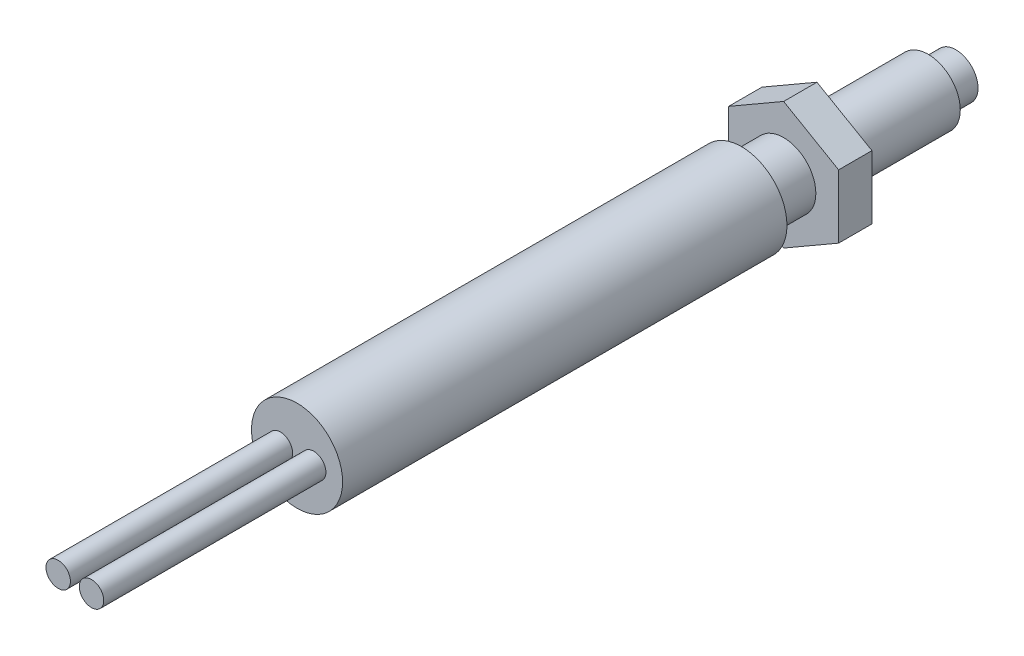
from build123d import *

# Parameters (mm, degrees)
ESQUISSE1_R        = 2.9
BOSS_EXTRU_1_DEPTH = 16.8
ESQUISSE2_R        = 2
BOSS_EXTRU_2_DEPTH = 2.5
ESQUISSE3_R        = 4.1
BOSS_EXTRU_3_DEPTH = 40
ESQUISSE4_R        = 1.1
BOSS_EXTRU_4_DEPTH = 20
BOSS_EXTRU_5_START = 10
BOSS_EXTRU_5_DEPTH = 3


with BuildPart() as part:
    # Esquisse1 → Boss.-Extru.1 (new body)
    with BuildSketch(Plane.XY):
        Circle(ESQUISSE1_R)
    extrude(amount=BOSS_EXTRU_1_DEPTH)

    # Esquisse2 → Boss.-Extru.2 (add)
    with BuildSketch(Plane(origin=(0, 0, 0), x_dir=(-1, 0, 0), z_dir=(0, 0, -1))):
        Circle(ESQUISSE2_R)
    extrude(amount=BOSS_EXTRU_2_DEPTH)

    # Esquisse3 → Boss.-Extru.3 (add)
    with BuildSketch(Plane.XY.offset(16.8)):
        Circle(ESQUISSE3_R)
    extrude(amount=BOSS_EXTRU_3_DEPTH)

    # Esquisse4 → Boss.-Extru.4 (add)
    with BuildSketch(Plane.XY.offset(56.8)):
        with Locations((-1.5, 0)):
            Circle(ESQUISSE4_R)
        with Locations(Location((1.5, 0, 0), (0, 0, 180))):
            Circle(ESQUISSE4_R)
    extrude(amount=BOSS_EXTRU_4_DEPTH)

    # Esquisse5 → Boss.-Extru.5 (add)
    with BuildSketch(Plane.XY.offset(BOSS_EXTRU_5_START)):
        Polygon((0, -5.715767665), (4.95, -2.857883832), (4.95, 2.857883832), (0, 5.715767665), (-4.95, 2.857883832), (-4.95, -2.857883832), align=None)
    extrude(amount=BOSS_EXTRU_5_DEPTH)


solid = part.part
